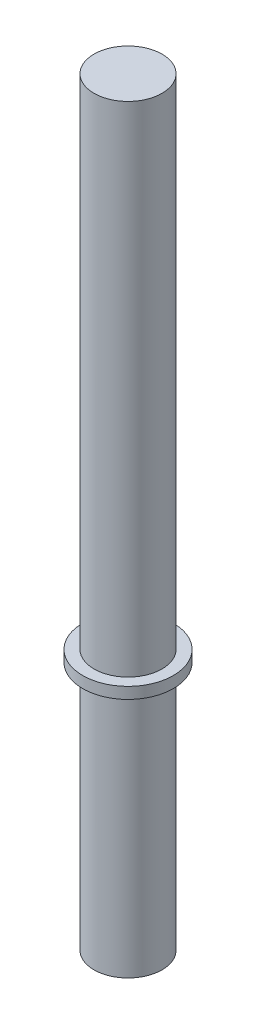
from build123d import *

# Parameters (mm, degrees)
SKETCH_1_R      = 1.5
EXTRUDE_1_DEPTH = 33.5
EXTRUDE_START   = -11
SKETCH_2_R      = 2
SKETCH_2_R_2    = 1.5
EXTRUDE_2_DEPTH = 0.5


with BuildPart() as part:
    # 草图1 → 凸台-拉伸1 (new body)
    with BuildSketch(Plane(origin=(0, 0, 0), x_dir=(1, 0, 0), z_dir=(0, 1, 0))):
        with Locations(Location((0, 0, 0), (0, 0, 270))):
            Circle(SKETCH_1_R)
    extrude(amount=EXTRUDE_1_DEPTH)

    # 草图2 → 凸台-拉伸2 (add)
    with BuildSketch(Plane.XZ.offset(EXTRUDE_START)):
        with Locations(Location((0, 0, 0), (0, 0, 270))):
            Circle(SKETCH_2_R)
        with Locations(Location((0, 0, 0), (0, 0, 270))):
            Circle(SKETCH_2_R_2, mode=Mode.SUBTRACT)
    extrude(amount=-EXTRUDE_2_DEPTH)


solid = part.part
